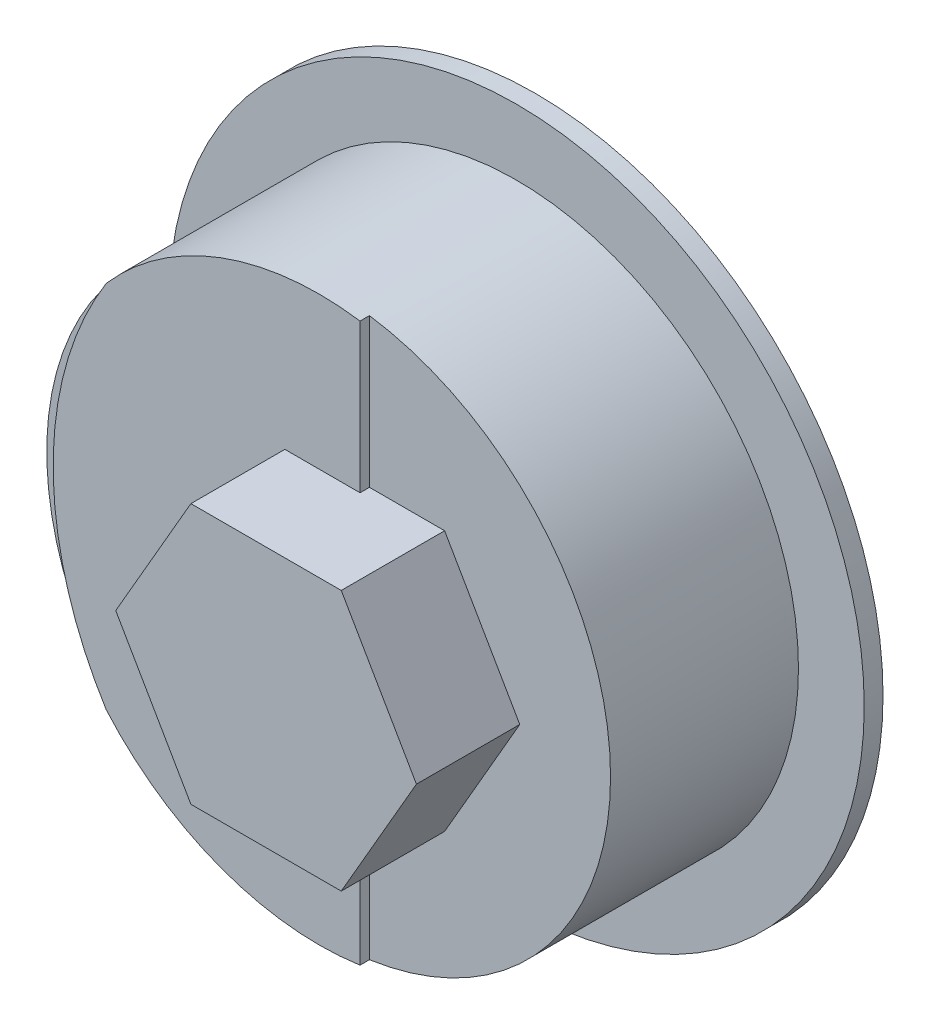
from build123d import *

# Parameters (mm, degrees)
SKETCH1_R           = 15
BOSS_EXTRUDE1_DEPTH = 5
SKETCH3_R           = 18.5
SKETCH3_R_2         = 15
BOSS_EXTRUDE3_DEPTH = 1
SKETCH2_R           = 7.5
BOSS_EXTRUDE2_DEPTH = 0.5
BOSS_EXTRUDE5_DEPTH = 5.5
BOSS_EXTRUDE6_START = 0.5
BOSS_EXTRUDE6_DEPTH = 0.5


with BuildPart() as part:
    # Sketch1 → Boss-Extrude1 (new, symmetric)
    with BuildSketch(Plane.XY):
        with Locations((-2.17, 0)):
            Circle(SKETCH1_R)
        Polygon((-2, 3.464101615), (-4, 0), (-2, -3.464101615), (2, -3.464101615), (4, 0), (2, 3.464101615), align=None, mode=Mode.SUBTRACT)
    extrude(amount=BOSS_EXTRUDE1_DEPTH, both=True)

    # Sketch3 → Boss-Extrude3 (add)
    # profile 1 of 2: a face of its own
    with BuildSketch(Plane(origin=(0, 0, -5), x_dir=(-1, 0, 0), z_dir=(0, 0, -1))):
        with Locations((2.17, 0)):
            Circle(SKETCH3_R)
        with Locations(Location((2.17, 0, 0), (0, 0, 180))):
            Circle(SKETCH3_R_2, mode=Mode.SUBTRACT)
    # profile 2 of 2: a face of its own
    with BuildSketch(Plane(origin=(0, 0, -5), x_dir=(-1, 0, 0), z_dir=(0, 0, -1))):
        with Locations(Location((2.17, 0, 0), (0, 0, 180))):
            Circle(SKETCH3_R_2)
        Polygon((-4, 0), (-2, 3.464101615), (2, 3.464101615), (4, 0), (2, -3.464101615), (-2, -3.464101615), align=None, mode=Mode.SUBTRACT)
    extrude(amount=BOSS_EXTRUDE3_DEPTH)

    # Sketch2 → Boss-Extrude2 (add)
    with BuildSketch(Plane(origin=(0, 0, -6), x_dir=(-1, 0, 0), z_dir=(0, 0, -1))):
        Circle(SKETCH2_R)
        Polygon((2, -3.464101615), (-2, -3.464101615), (-4, 0), (-2, 3.464101615), (2, 3.464101615), (4, 0), align=None, mode=Mode.SUBTRACT)
    extrude(amount=BOSS_EXTRUDE2_DEPTH)

    # Sketch4 → Boss-Extrude5 (add)
    with BuildSketch(Plane.XY.offset(5)):
        Polygon((4, 6.92820323), (-4, 6.92820323), (-8, 0), (-4, -6.92820323), (4, -6.92820323), (8, 0), align=None)
    extrude(amount=BOSS_EXTRUDE5_DEPTH)

    # Sketch5 → Boss-Extrude6 (add)
    with BuildSketch(Plane.XY.offset(5).offset(BOSS_EXTRUDE6_START)):
        with BuildLine():
            ThreePointArc((-13.508064516, -9.820809184), (-7.396562926, -14.059980085), (0, -14.842206709))
            Line((0, -14.842206709), (0, -6.92820323))
            Line((0, -6.92820323), (-4, -6.92820323))
            Line((-4, -6.92820323), (-8, 0))
            Line((-8, 0), (-4, 6.92820323))
            Line((-4, 6.92820323), (0, 6.92820323))
            Line((0, 6.92820323), (0, 14.842206709))
            ThreePointArc((0, 14.842206709), (-7.396562926, 14.059980085), (-13.508064516, 9.820809184))
            ThreePointArc((-13.508064516, 9.820809184), (-16.33, 0), (-13.508064516, -9.820809184))
        make_face()
    extrude(amount=-BOSS_EXTRUDE6_DEPTH)


solid = part.part
